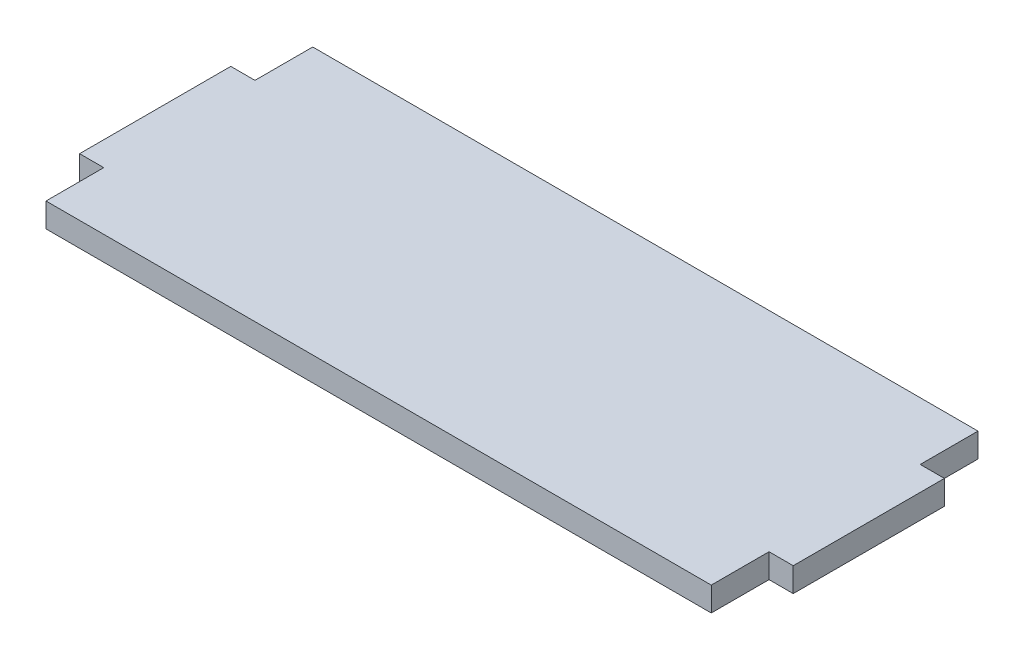
from build123d import *

# Parameters (mm, degrees)
SKETCH1_W           = 8
SKETCH1_H           = 50
BOSS_EXTRUDE1_DEPTH = 8


with BuildPart() as part:
    # Sketch1 → Boss-Extrude1 (new body)
    with BuildSketch(Plane(origin=(0, 0, 0), x_dir=(1, 0, 0), z_dir=(0, 1, 0))):
        with Locations((-4, 44.105)):
            Rectangle(SKETCH1_W, SKETCH1_H)
        Polygon((110, 0), (110, 88.21), (0, 88.21), (0, 69.105), (0, 19.105), (0, 0), align=None)
        Polygon((220, 88.21), (110, 88.21), (110, 0), (220, 0), (220, 19.105), (220, 69.105), align=None)
        with Locations((224, 44.105)):
            Rectangle(SKETCH1_W, SKETCH1_H)
    extrude(amount=BOSS_EXTRUDE1_DEPTH)


solid = part.part
